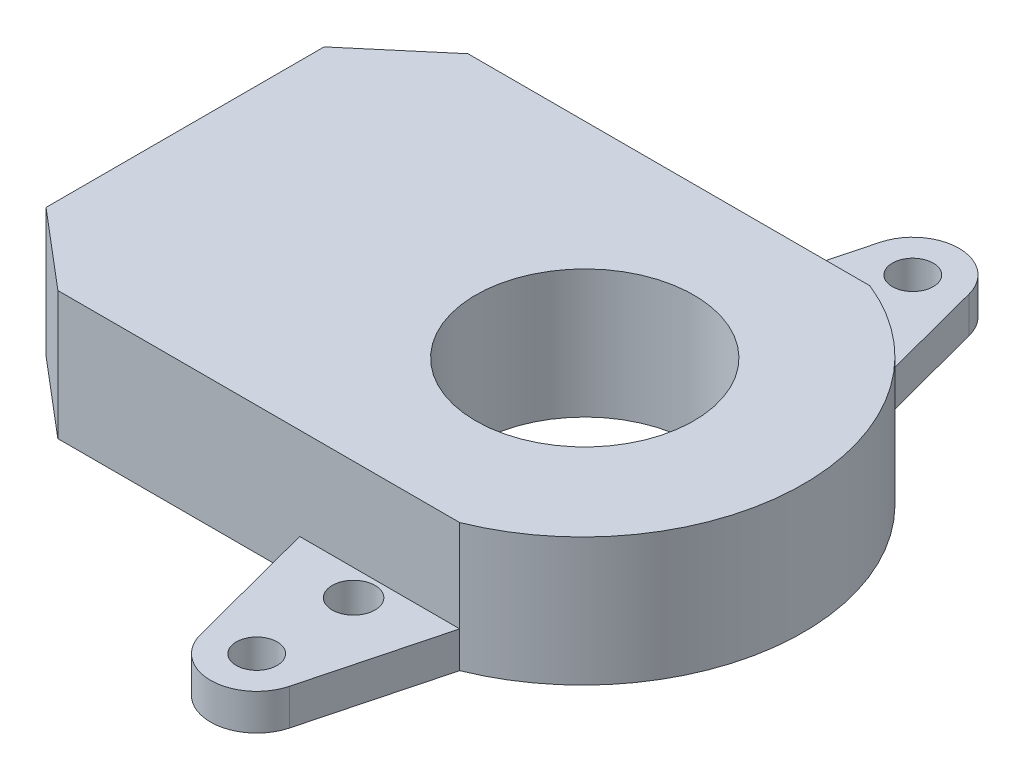
from build123d import *

# Parameters (mm, degrees)
BOSS_EXTRUDE1_DEPTH = 9
SKETCH2_R           = 1.435
SKETCH2_R_2         = 1.5
BOSS_EXTRUDE2_DEPTH = 2.54
SKETCH3_R           = 7.65
CUT_EXTRUDE1_DEPTH  = 52.496474637


with BuildPart() as part:
    # Sketch1 → Boss-Extrude1 (new body)
    with BuildSketch(Plane(origin=(0, 0, 0), x_dir=(1, 0, 0), z_dir=(0, 1, 0))):
        with BuildLine():
            Line((0, -9.7536), (0, 9.7536))
            Line((0, 9.7536), (5.464049586, 14.385))
            Line((5.464049586, 14.385), (33.652501624, 14.385))
            ThreePointArc((33.652501624, 14.385), (40.719855435, 8.682632804), (43.38, 0))
            ThreePointArc((43.38, 0), (40.719855435, -8.682632804), (33.652501624, -14.385))
            Line((33.652501624, -14.385), (5.464049586, -14.385))
            Line((5.464049586, -14.385), (0, -9.7536))
        make_face()
    extrude(amount=BOSS_EXTRUDE1_DEPTH)

    # Sketch2 → Boss-Extrude2 (add)
    # profile 1 of 2: a face of its own
    with BuildSketch(Plane.XZ):
        with BuildLine():
            Line((31.171361508, -23.834680852), (33.652501624, -14.385))
            Line((33.652501624, -14.385), (22.427498376, -14.385))
            Line((22.427498376, -14.385), (24.908638492, -23.834680852))
            ThreePointArc((24.908638492, -23.834680852), (28.04, -26.25), (31.171361508, -23.834680852))
        make_face()
        with Locations(Location((28.04, -23.0125, 0), (0, 0, 270))):
            Circle(SKETCH2_R, mode=Mode.SUBTRACT)
        with Locations(Location((28.04, -16.215, 0), (0, 0, 270))):
            Circle(SKETCH2_R_2, mode=Mode.SUBTRACT)
    # profile 2 of 2: a face of its own
    with BuildSketch(Plane.XZ):
        with BuildLine():
            Line((22.427498376, 14.385), (33.652501624, 14.385))
            Line((33.652501624, 14.385), (31.171361508, 23.834680852))
            ThreePointArc((31.171361508, 23.834680852), (28.04, 26.25), (24.908638492, 23.834680852))
            Line((24.908638492, 23.834680852), (22.427498376, 14.385))
        make_face()
        with Locations(Location((28.04, 16.215, 0), (0, 0, 270))):
            Circle(SKETCH2_R_2, mode=Mode.SUBTRACT)
        with Locations(Location((28.04, 23.0125, 0), (0, 0, 270))):
            Circle(SKETCH2_R, mode=Mode.SUBTRACT)
    extrude(amount=-BOSS_EXTRUDE2_DEPTH)

    # Sketch3 → Cut-Extrude1 (cut, through all)
    with BuildSketch(Plane(origin=(0, 9, 0), x_dir=(1, 0, 0), z_dir=(0, 1, 0))):
        with Locations(Location((28.04, 0, 0), (0, 0, 270))):
            Circle(SKETCH3_R)
    extrude(amount=-CUT_EXTRUDE1_DEPTH, mode=Mode.SUBTRACT)


solid = part.part
